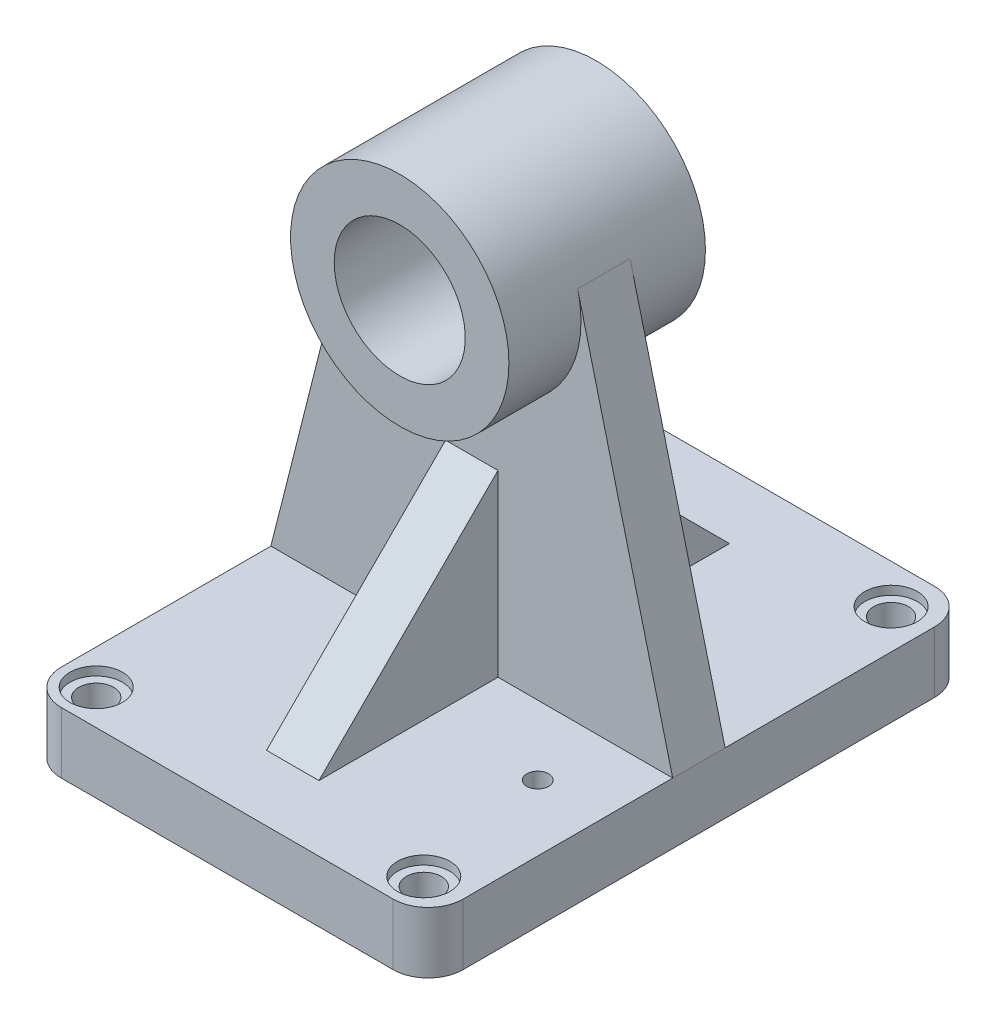
from build123d import *

# Parameters (mm, degrees)
SKETCH_1_R                   = 25
SKETCH_1_R_2                 = 15
EXTRUDE_1_DEPTH              = 22.5
SKETCH_2_W                   = 92
SKETCH_2_H                   = 14
EXTRUDE_2_DEPTH              = 62
EXTRUDE_3_DEPTH              = 6
RIB_1_REACH                  = 123.639
SKETCH_4_WALL_W              = 303.26037525
SKETCH_4_WALL_H              = 12
FILLET_1_R                   = 8
HOLE_WIZARD_M5_1_D           = 8
HOLE_WIZARD_M5_1_CBORE_D     = 12
HOLE_WIZARD_M5_1_CBORE_DEPTH = 2
HOLE_WIZARD_M6_1_D           = 5
PATTERN_LINEAR_7_COUNT       = 2
PATTERN_LINEAR_7_PITCH       = 75
PATTERN_LINEAR_7_COUNT_DIR2  = 2
PATTERN_LINEAR_7_PITCH_DIR2  = 107


with BuildPart() as part:
    # 스케치1 → 보스-돌출1 (new, symmetric)
    with BuildSketch(Plane.XY):
        with Locations(Location((0, 0, 0), (0, 0, 180))):
            Circle(SKETCH_1_R)
        with Locations(Location((0, 0, 0), (0, 0, 180))):
            Circle(SKETCH_1_R_2, mode=Mode.SUBTRACT)
    extrude(amount=EXTRUDE_1_DEPTH, both=True)



with BuildPart() as body_2:
    # 스케치2 → 보스-돌출2 (new, symmetric)
    with BuildSketch(Plane.XY):
        with Locations((0, -87)):
            Rectangle(SKETCH_2_W, SKETCH_2_H)
    extrude(amount=EXTRUDE_2_DEPTH, both=True)


with BuildPart() as part_1:
    add(part.part)

    add(body_2.part)  # 보스-돌출3 merges body 2
    # 스케치3 → 보스-돌출3 (add, symmetric)
    with BuildSketch(Plane.XY):
        with BuildLine():
            Line((-24.238210613, 6.124471102), (-46, -80))
            Line((-46, -80), (46, -80))
            Line((46, -80), (24.238210613, 6.124471102))
            ThreePointArc((24.238210613, 6.124471102), (0, -25), (-24.238210613, 6.124471102))
        make_face()
    extrude(amount=EXTRUDE_3_DEPTH, both=True)

    # 스케치4 wall → 보강대1 (add, up to next)
    with BuildSketch(Plane(origin=(0, -59.5, 26.5), x_dir=(0, -0.707106781187, 0.707106781187), z_dir=(0, -0.707106781187, -0.707106781187)), mode=Mode.PRIVATE) as rib_1_sk1:
        Rectangle(SKETCH_4_WALL_W, SKETCH_4_WALL_H)
    rib_1_tool1 = extrude(rib_1_sk1.sketch, amount=RIB_1_REACH, mode=Mode.PRIVATE) - part_1.part
    rib_1 = rib_1_tool1.solids().sort_by_distance((0, -59.5, 26.5))[0]
    add(rib_1)

    # 대칭 복사1: 보강대1 across plane
    add(rib_1.mirror(Plane.XY))

    # 필렛1
    fillet_1_edges = [part_1.edges().sort_by_distance(p)[0] for p in [
        (-46, -87, -62),
        (46, -87, 62),
        (46, -87, -62),
        (-46, -87, 62),
    ]]
    fillet(fillet_1_edges, radius=FILLET_1_R)

    # M5 소켓 머리 캡 나사용 카운터보어1 (through all)
    with Locations(Plane(origin=(-38, -80, 54), x_dir=(0, 0, 1), z_dir=(0, 1, 0))):
        with Locations((0, 0)):
            hole_wizard_m5_1 = CounterBoreHole(HOLE_WIZARD_M5_1_D / 2, HOLE_WIZARD_M5_1_CBORE_D / 2, HOLE_WIZARD_M5_1_CBORE_DEPTH)

    # M6 나사 구멍1 (through all)
    with Locations(Plane(origin=(30.943238256, -80, 21.843950173), x_dir=(0, 0, 1), z_dir=(0, 1, 0))):
        with Locations((0, 0)):
            Hole(HOLE_WIZARD_M6_1_D / 2)

    # 선형 패턴7: Hole Wizard M5 _ _ _ _ _1 2 × 2
    with Locations(*[(i * PATTERN_LINEAR_7_PITCH, 0, -j * PATTERN_LINEAR_7_PITCH_DIR2) for i in range(PATTERN_LINEAR_7_COUNT) for j in range(PATTERN_LINEAR_7_COUNT_DIR2) if (i, j) != (0, 0)]):
        add(hole_wizard_m5_1, mode=Mode.SUBTRACT)


solid = part_1.part
